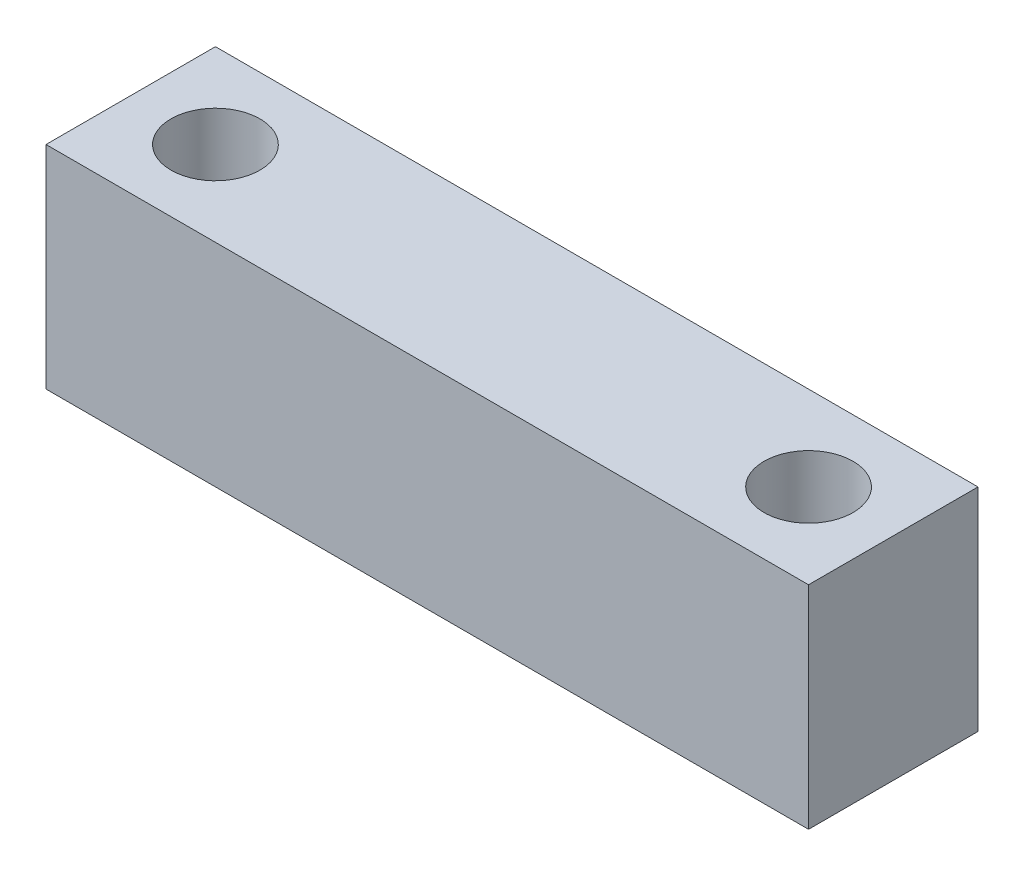
from build123d import *

# Parameters (mm, degrees)
SKETCH1_W           = 36
SKETCH1_H           = 8
SKETCH1_R           = 2.1
BOSS_EXTRUDE1_DEPTH = 10


with BuildPart() as part:
    # Sketch1 → Boss-Extrude1 (new body)
    with BuildSketch(Plane(origin=(0, 0, 0), x_dir=(1, 0, 0), z_dir=(0, 1, 0))):
        with Locations((18, -4)):
            Rectangle(SKETCH1_W, SKETCH1_H)
        with Locations(Location((4, -4, 0), (0, 0, 270))):
            Circle(SKETCH1_R, mode=Mode.SUBTRACT)
        with Locations(Location((32, -4, 0), (0, 0, 90))):
            Circle(SKETCH1_R, mode=Mode.SUBTRACT)
    extrude(amount=BOSS_EXTRUDE1_DEPTH)


solid = part.part
